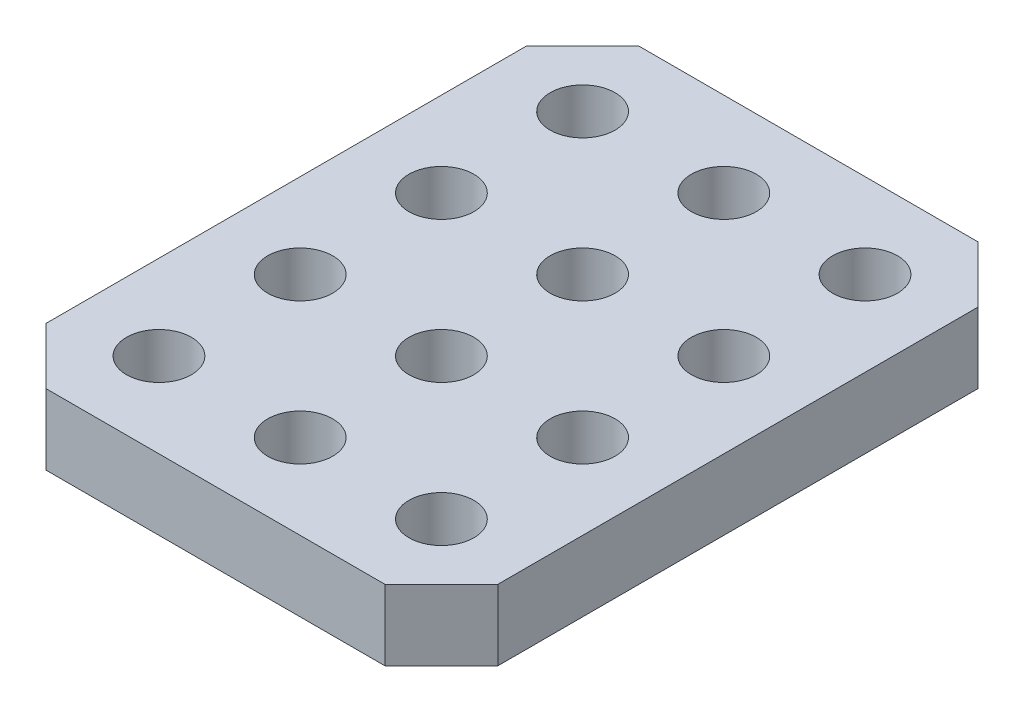
from build123d import *

# Parameters (mm, degrees)
SKETCH1_R           = 2.921
BOSS_EXTRUDE1_DEPTH = 6.35


with BuildPart() as part:
    # Sketch1 → Boss-Extrude1 (new body)
    with BuildSketch(Plane(origin=(0, 0, 0), x_dir=(1, 0, 0), z_dir=(0, 1, 0))):
        Polygon((0, 48.26), (5.08, 53.34), (35.56, 53.34), (40.64, 48.26), (40.64, 5.08), (35.56, 0), (5.08, 0), (0, 5.08), align=None)
        with Locations(Location((7.62, 7.62, 0), (0, 0, 270))):
            Circle(SKETCH1_R, mode=Mode.SUBTRACT)
        with Locations(Location((20.32, 7.62, 0), (0, 0, 270))):
            Circle(SKETCH1_R, mode=Mode.SUBTRACT)
        with Locations(Location((33.02, 7.62, 0), (0, 0, 270))):
            Circle(SKETCH1_R, mode=Mode.SUBTRACT)
        with Locations(Location((20.32, 20.32, 0), (0, 0, 270))):
            Circle(SKETCH1_R, mode=Mode.SUBTRACT)
        with Locations(Location((33.02, 20.32, 0), (0, 0, 270))):
            Circle(SKETCH1_R, mode=Mode.SUBTRACT)
        with Locations(Location((20.32, 33.02, 0), (0, 0, 270))):
            Circle(SKETCH1_R, mode=Mode.SUBTRACT)
        with Locations(Location((33.02, 33.02, 0), (0, 0, 270))):
            Circle(SKETCH1_R, mode=Mode.SUBTRACT)
        with Locations(Location((20.32, 45.72, 0), (0, 0, 270))):
            Circle(SKETCH1_R, mode=Mode.SUBTRACT)
        with Locations(Location((33.02, 45.72, 0), (0, 0, 270))):
            Circle(SKETCH1_R, mode=Mode.SUBTRACT)
        with Locations(Location((7.62, 20.32, 0), (0, 0, 270))):
            Circle(SKETCH1_R, mode=Mode.SUBTRACT)
        with Locations(Location((7.62, 33.02, 0), (0, 0, 270))):
            Circle(SKETCH1_R, mode=Mode.SUBTRACT)
        with Locations(Location((7.62, 45.72, 0), (0, 0, 270))):
            Circle(SKETCH1_R, mode=Mode.SUBTRACT)
    extrude(amount=BOSS_EXTRUDE1_DEPTH)


solid = part.part
